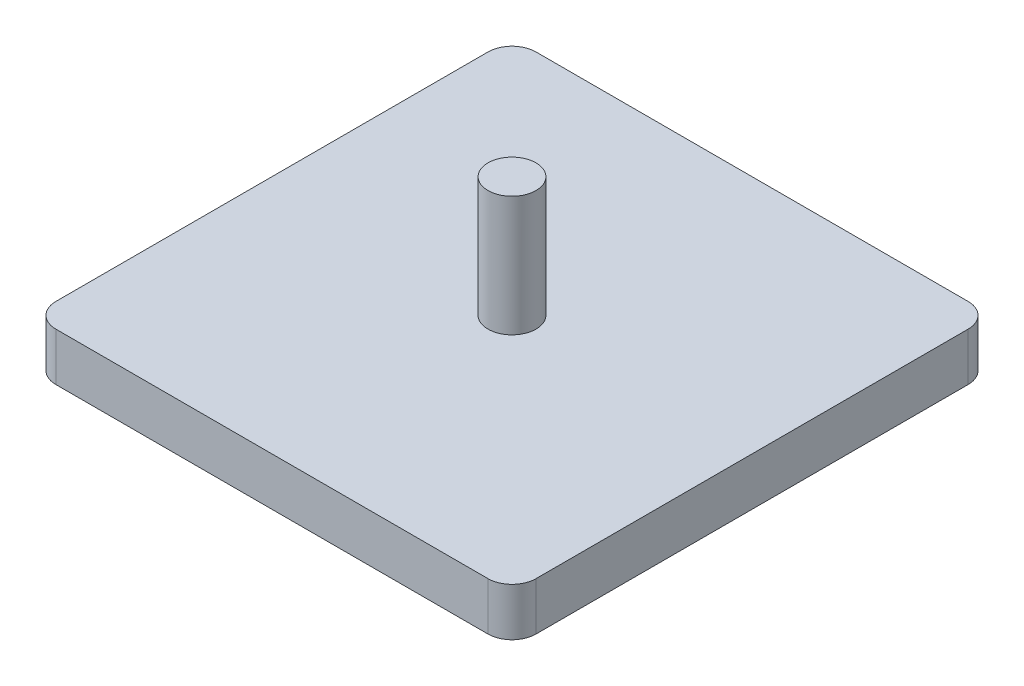
from build123d import *

# Parameters (mm, degrees)
SKETCH2_W           = 20
SKETCH2_H           = 20
BOSS_EXTRUDE1_DEPTH = 2
SKETCH3_R           = 1
BOSS_EXTRUDE2_DEPTH = 5
FILLET1_R           = 1


with BuildPart() as part:
    # Sketch2 → Boss-Extrude1 (new body)
    with BuildSketch(Plane(origin=(0, 0, 0), x_dir=(1, 0, 0), z_dir=(0, 1, 0))):
        Rectangle(SKETCH2_W, SKETCH2_H)
    extrude(amount=BOSS_EXTRUDE1_DEPTH)

    # Sketch3 → Boss-Extrude2 (add)
    with BuildSketch(Plane(origin=(0, 2, 0), x_dir=(1, 0, 0), z_dir=(0, 1, 0))):
        with Locations(Location((0, 0, 0), (0, 0, 90))):
            Circle(SKETCH3_R)
    extrude(amount=BOSS_EXTRUDE2_DEPTH)

    # Fillet1
    fillet1_edges = [part.edges().sort_by_distance(p)[0] for p in [
        (-10, 1, -10),
        (10, 1, -10),
        (10, 1, 10),
        (-10, 1, 10),
    ]]
    fillet(fillet1_edges, radius=FILLET1_R)


solid = part.part
